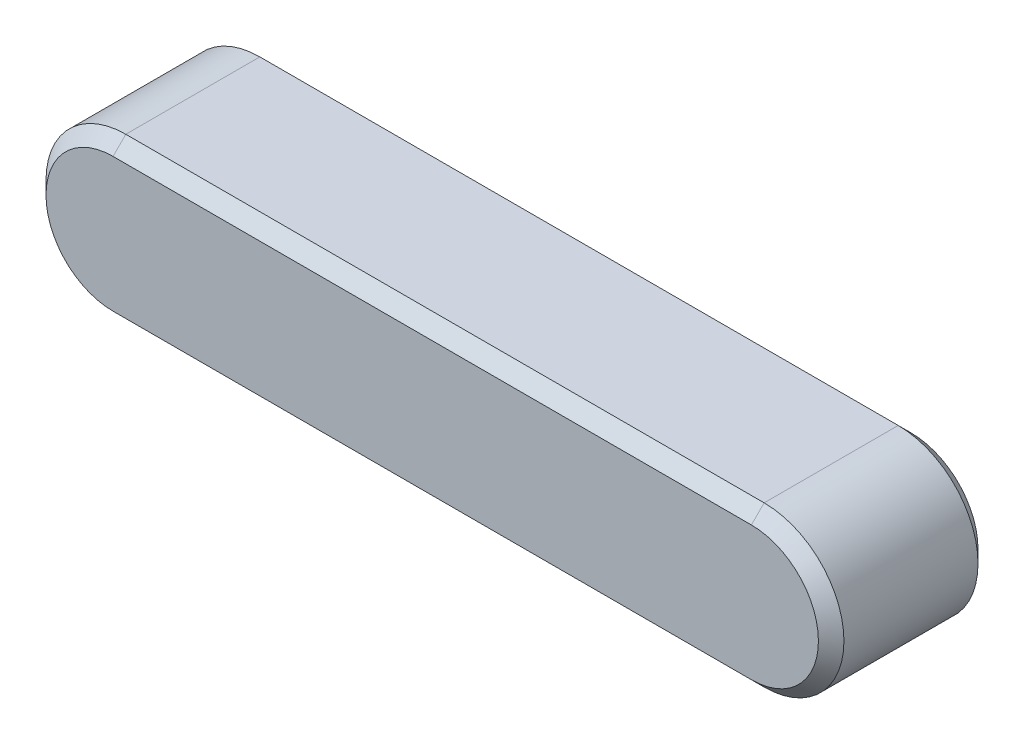
from build123d import *

# Parameters (mm, degrees)
BASEKEY_DEPTH = 2.5
CHAMFER1_SIZE = 0.4


with BuildPart() as part:
    # Sketch1 → BaseKey (new, symmetric)
    with BuildSketch(Plane.XY):
        with BuildLine():
            Line((-20, 2.5), (0, 2.5))
            ThreePointArc((0, 2.5), (2.5, 0), (0, -2.5))
            Line((0, -2.5), (-20, -2.5))
            ThreePointArc((-20, -2.5), (-22.5, 0), (-20, 2.5))
        make_face()
    extrude(amount=BASEKEY_DEPTH, both=True)

    # Chamfer1
    chamfer1_edges = [part.edges().sort_by_distance(p)[0] for p in [
        (2.5, 0, 2.5),
        (-10, 2.5, 2.5),
        (-22.5, 0, 2.5),
        (-10, 2.5, -2.5),
        (2.5, 0, -2.5),
        (-10, -2.5, -2.5),
        (-22.5, 0, -2.5),
        (-10, -2.5, 2.5),
    ]]
    chamfer(chamfer1_edges, length=CHAMFER1_SIZE)


solid = part.part
